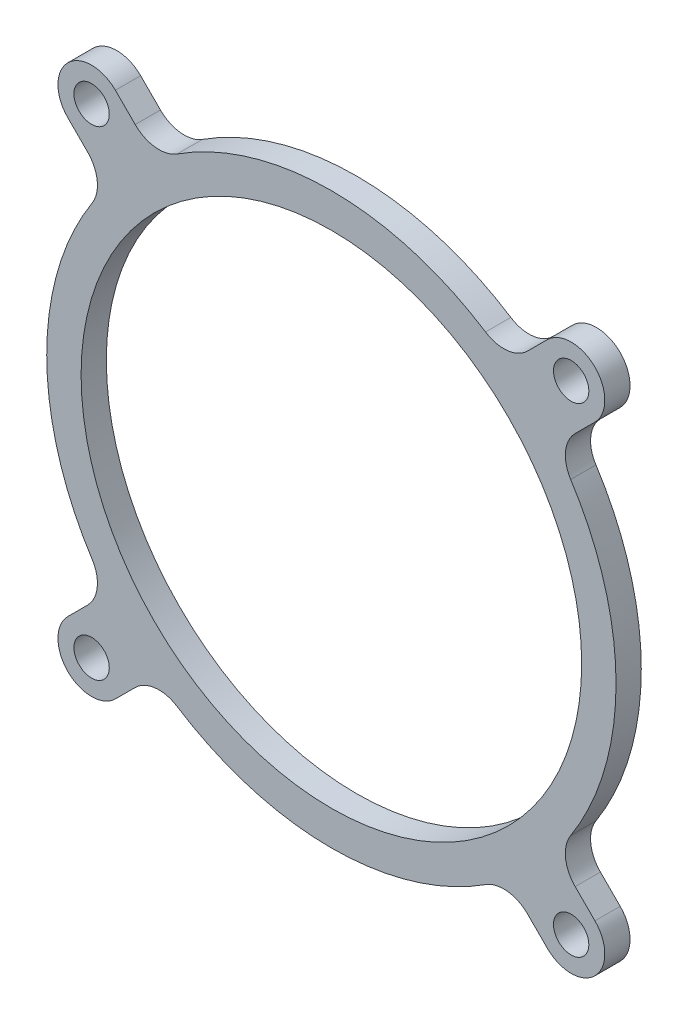
from build123d import *

# Parameters (mm, degrees)
SKETCH_1_R      = 2.1
SKETCH_1_R_2    = 29.75
EXTRUDE_1_DEPTH = 3


with BuildPart() as part:
    # 草图1 → 凸台-拉伸1 (new body)
    with BuildSketch(Plane.XY):
        with BuildLine():
            Line((49.221320344, -54.878174593), (46.870064467, -52.526918716))
            ThreePointArc((46.870064467, -52.526918716), (44.466937039, -51.378020085), (41.875216055, -51.992814233))
            ThreePointArc((41.875216055, -51.992814233), (23.55, -57.385), (5.224783944, -51.992814233))
            ThreePointArc((5.224783944, -51.992814233), (2.633062961, -51.378020085), (0.229935533, -52.526918716))
            Line((0.229935533, -52.526918716), (-2.121320344, -54.878174593))
            ThreePointArc((-2.121320344, -54.878174593), (-7.778174593, -54.878174593), (-7.778174593, -49.221320343))
            Line((-7.778174593, -49.221320343), (-5.426918716, -46.870064466))
            ThreePointArc((-5.426918716, -46.870064466), (-4.278020085, -44.466937039), (-4.892814233, -41.875216055))
            ThreePointArc((-4.892814233, -41.875216055), (-10.285, -23.55), (-4.892814233, -5.224783944))
            ThreePointArc((-4.892814233, -5.224783944), (-4.278020085, -2.633062961), (-5.426918716, -0.229935533))
            Line((-5.426918716, -0.229935533), (-7.778174593, 2.121320344))
            ThreePointArc((-7.778174593, 2.121320344), (-7.778174593, 7.778174593), (-2.121320343, 7.778174593))
            Line((-2.121320343, 7.778174593), (0.229935534, 5.426918716))
            ThreePointArc((0.229935534, 5.426918716), (2.633062962, 4.278020085), (5.224783945, 4.892814234))
            ThreePointArc((5.224783945, 4.892814234), (23.55, 10.285), (41.875216056, 4.892814233))
            ThreePointArc((41.875216056, 4.892814233), (44.466937039, 4.278020085), (46.870064467, 5.426918716))
            Line((46.870064467, 5.426918716), (49.221320344, 7.778174593))
            ThreePointArc((49.221320344, 7.778174593), (54.878174593, 7.778174593), (54.878174593, 2.121320344))
            Line((54.878174593, 2.121320344), (52.526918716, -0.229935533))
            ThreePointArc((52.526918716, -0.229935533), (51.378020085, -2.633062961), (51.992814234, -5.224783945))
            ThreePointArc((51.992814234, -5.224783945), (57.385, -23.55), (51.992814233, -41.875216055))
            ThreePointArc((51.992814233, -41.875216055), (51.378020085, -44.466937039), (52.526918716, -46.870064467))
            Line((52.526918716, -46.870064467), (54.878174593, -49.221320344))
            ThreePointArc((54.878174593, -49.221320344), (54.878174593, -54.878174593), (49.221320344, -54.878174593))
        make_face()
        with Locations((52.049747468, -52.049747468)):
            Circle(SKETCH_1_R, mode=Mode.SUBTRACT)
        with Locations((-4.949747468, -52.049747468)):
            Circle(SKETCH_1_R, mode=Mode.SUBTRACT)
        with Locations((-4.949747468, 4.949747468)):
            Circle(SKETCH_1_R, mode=Mode.SUBTRACT)
        with Locations((52.049747468, 4.949747468)):
            Circle(SKETCH_1_R, mode=Mode.SUBTRACT)
        with Locations((23.55, -23.55)):
            Circle(SKETCH_1_R_2, mode=Mode.SUBTRACT)
    extrude(amount=EXTRUDE_1_DEPTH)


solid = part.part
